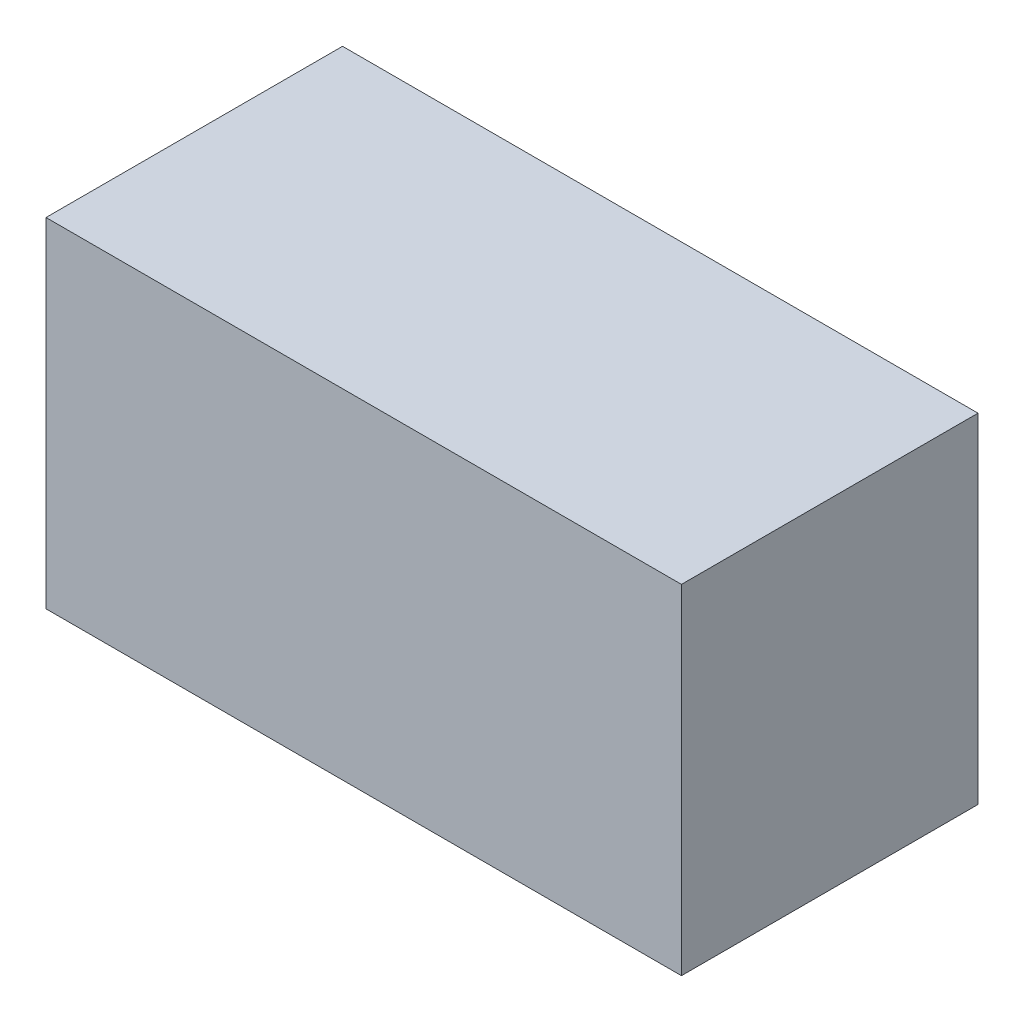
from build123d import *

# Parameters (mm, degrees)
SKETCH1_W           = 45
SKETCH1_H           = 24
BOSS_EXTRUDE2_DEPTH = 21


with BuildPart() as part:
    # Sketch1 → Boss-Extrude2 (new body)
    with BuildSketch(Plane.XY):
        with Locations((153.404412211, -65.558555664)):
            Rectangle(SKETCH1_W, SKETCH1_H)
    extrude(amount=BOSS_EXTRUDE2_DEPTH)


solid = part.part
